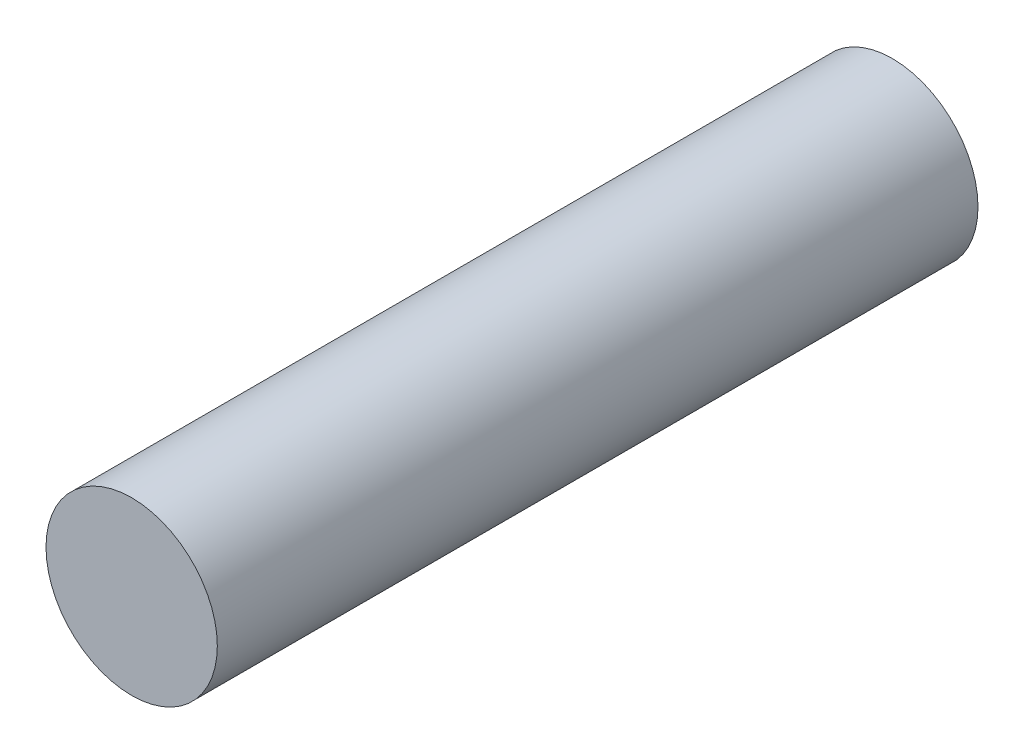
from build123d import *

# Parameters (mm, degrees)
SKETCH1_R           = 12.5
BOSS_EXTRUDE1_DEPTH = 111


with BuildPart() as part:
    # Sketch1 → Boss-Extrude1 (new body)
    with BuildSketch(Plane.XY):
        Circle(SKETCH1_R)
    extrude(amount=BOSS_EXTRUDE1_DEPTH)


solid = part.part
